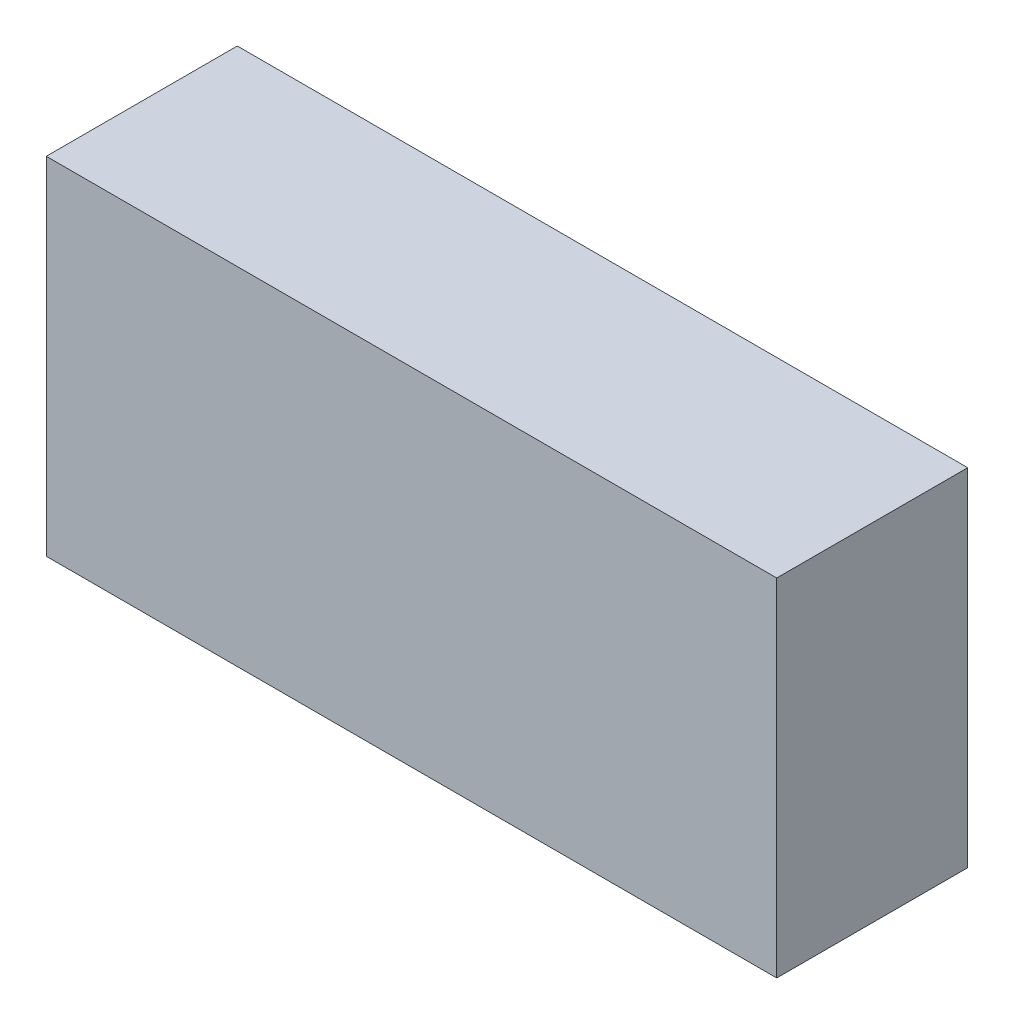
from build123d import *

# Parameters (mm, degrees)
BOSS_EXTRUDE1_DEPTH      = 27.7876
BOSS_EXTRUDE1_DEPTH_BACK = 30.3276
SKETCH1_W                = 222.25
SKETCH1_H                = 105.41


with BuildPart() as part:
    # Sketch1 → Boss-Extrude1 (new, two sides: drawn at the far end of the back side and taken through both)
    with BuildSketch(Plane.XY.offset(-BOSS_EXTRUDE1_DEPTH_BACK)):
        with Locations((-5.385788961, -12.79525)):
            Rectangle(SKETCH1_W, SKETCH1_H)
    extrude(amount=BOSS_EXTRUDE1_DEPTH + BOSS_EXTRUDE1_DEPTH_BACK)


solid = part.part
